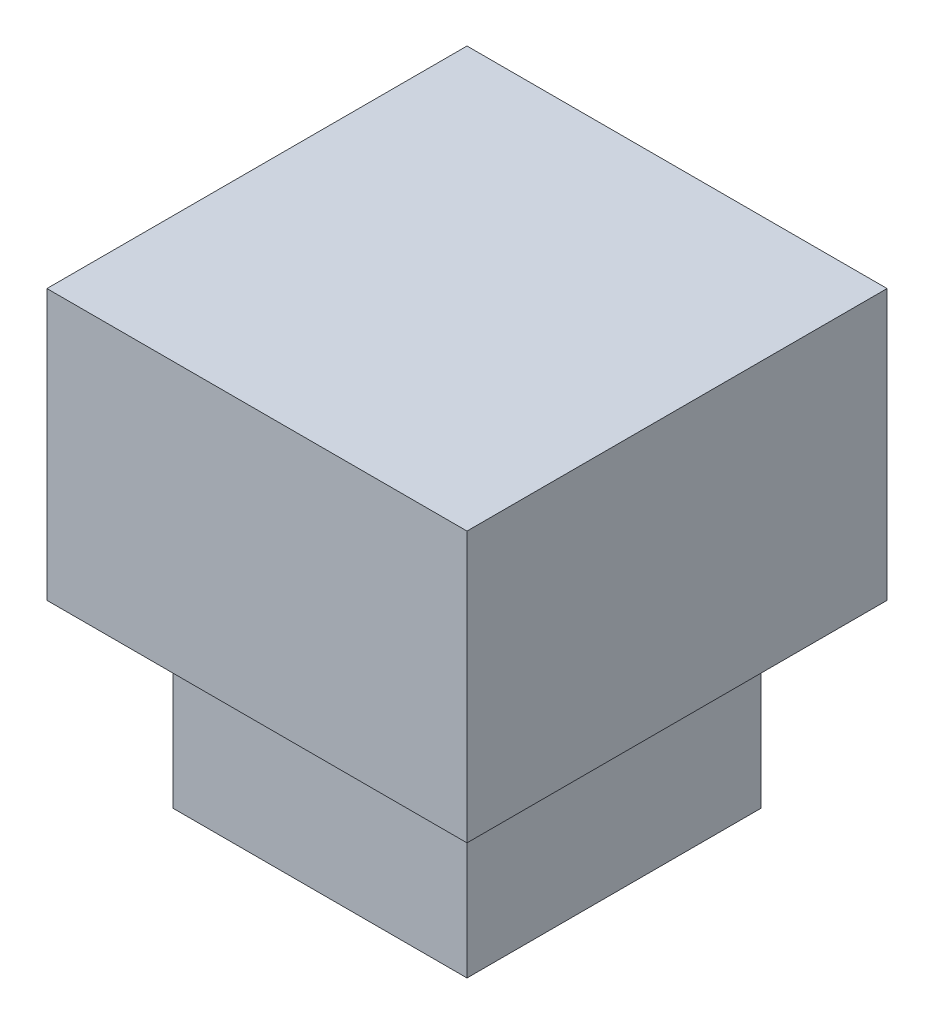
from build123d import *

# Parameters (mm, degrees)
CROQUIS1_W              = 4.9
CROQUIS1_H              = 4.9
SALIENTE_EXTRUIR1_DEPTH = 3
CROQUIS2_W              = 7
CROQUIS2_H              = 7
SALIENTE_EXTRUIR2_DEPTH = 4.5


with BuildPart() as part:
    # Croquis1 → Saliente-Extruir1 (new body)
    with BuildSketch(Plane(origin=(0, 0, 0), x_dir=(1, 0, 0), z_dir=(0, 1, 0))):
        Rectangle(CROQUIS1_W, CROQUIS1_H)
    extrude(amount=SALIENTE_EXTRUIR1_DEPTH)

    # Croquis2 → Saliente-Extruir2 (add)
    with BuildSketch(Plane(origin=(0, 3, 0), x_dir=(1, 0, 0), z_dir=(0, 1, 0))):
        Rectangle(CROQUIS2_W, CROQUIS2_H)
    extrude(amount=SALIENTE_EXTRUIR2_DEPTH)


solid = part.part
